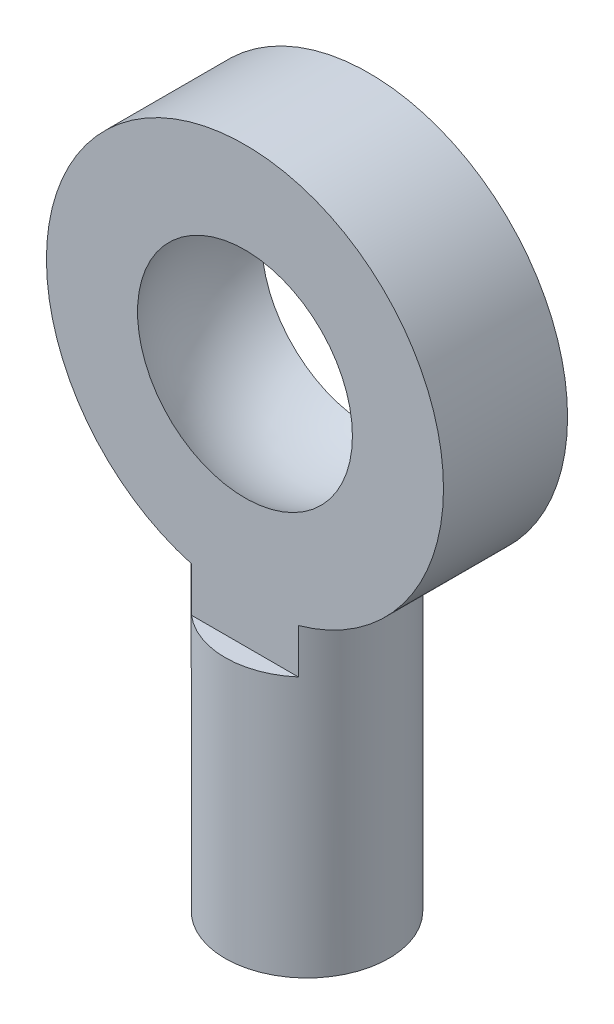
from build123d import *

# Parameters (mm, degrees)
SKETCH_2_R          = 1.65
EXTRUDE_1_DEPTH     = 10
SKETCH_3_R          = 4
EXTRUDE_2_DEPTH     = 1.25
CUT_EXTRUDE_1_DEPTH = 2.5
CUT_EXTRUDE_2_DEPTH = 2.25
SKETCH_8_R          = 1.1
CUT_EXTRUDE_4_DEPTH = 5
SKETCH_7_R          = 2
CUT_EXTRUDE_5_DEPTH = 10


with BuildPart() as part:
    # 草图2 → 凸台-拉伸1 (new body)
    with BuildSketch(Plane(origin=(0, 0, 0), x_dir=(1, 0, 0), z_dir=(0, 1, 0))):
        with Locations(Location((0, 0, 0), (0, 0, 270))):
            Circle(SKETCH_2_R)
    extrude(amount=EXTRUDE_1_DEPTH)

    # 草图3 → 凸台-拉伸2 (add, symmetric)
    with BuildSketch(Plane.XY):
        with Locations((0, 10)):
            Circle(SKETCH_3_R)
    extrude(amount=EXTRUDE_2_DEPTH, both=True)

    # 草图5 → 切除-拉伸1 (cut, symmetric)
    with BuildSketch(Plane(origin=(0, 10, 0), x_dir=(1, 0, 0), z_dir=(0, 1, 0))):
        with BuildLine():
            Line((1.077032961, -1.25), (-1.077032961, -1.25))
            ThreePointArc((-1.077032961, -1.25), (0, -1.65), (1.077032961, -1.25))
        make_face()
        with BuildLine():
            Line((-1.077032961, 1.25), (1.077032961, 1.25))
            ThreePointArc((1.077032961, 1.25), (0, 1.65), (-1.077032961, 1.25))
        make_face()
    extrude(amount=CUT_EXTRUDE_1_DEPTH, both=True, mode=Mode.SUBTRACT)

    # 草图6 → 切除-拉伸2 (cut, symmetric)
    with BuildSketch(Plane(origin=(0, 7.5, 0), x_dir=(1, 0, 0), z_dir=(0, 1, 0))):
        with BuildLine():
            Line((-1.077032961, 1.25), (1.077032961, 1.25))
            ThreePointArc((1.077032961, 1.25), (0, 1.65), (-1.077032961, 1.25))
        make_face()
        with BuildLine():
            Line((1.077032961, -1.25), (-1.077032961, -1.25))
            ThreePointArc((-1.077032961, -1.25), (0, -1.65), (1.077032961, -1.25))
        make_face()
    extrude(amount=CUT_EXTRUDE_2_DEPTH, both=True, mode=Mode.SUBTRACT)

    # 草图8 → 切除-拉伸4 (cut)
    with BuildSketch(Plane.XZ):
        with Locations(Location((0, 0, 0), (0, 0, 270))):
            Circle(SKETCH_8_R)
    extrude(amount=-CUT_EXTRUDE_4_DEPTH, mode=Mode.SUBTRACT)

    # 草图7 → 切除-拉伸5 (cut)
    with BuildSketch(Plane.XY.offset(1.25)):
        with Locations((0, 10)):
            Circle(SKETCH_7_R)
    extrude(amount=-CUT_EXTRUDE_5_DEPTH, mode=Mode.SUBTRACT)

    # 草图9 → 切除-旋转2 (revolve, cut)
    with BuildSketch(Plane.XY):
        with BuildLine():
            Line((0, 12.5), (0, 7.5))
            ThreePointArc((0, 7.5), (2.5, 10), (0, 12.5))
        make_face()
    revolve(axis=Axis((0, 12.5, 0), (0, -1, 0)), mode=Mode.SUBTRACT)


solid = part.part
